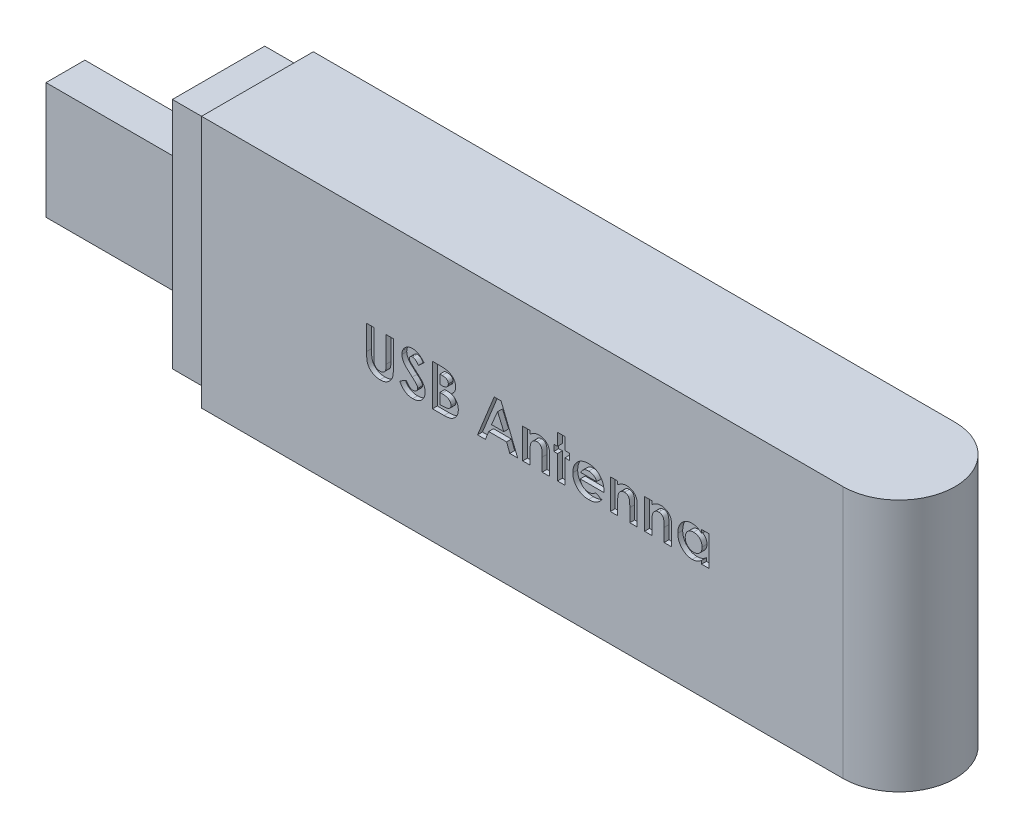
from build123d import *

# Parameters (mm, degrees)
SKETCH1_W           = 70
SKETCH1_H           = 11.5
BOSS_EXTRUDE1_DEPTH = 26
SKETCH2_W           = 11.5
SKETCH2_H           = 26
SKETCH2_W_2         = 9.5
SKETCH2_H_2         = 24
CUT_EXTRUDE1_DEPTH  = 4
SKETCH3_W           = 4
SKETCH3_H           = 12
BOSS_EXTRUDE2_DEPTH = 14
CUT_EXTRUDE3_DEPTH  = 0.5


with BuildPart() as part:
    # Sketch1 → Boss-Extrude1 (new body)
    with BuildSketch(Plane(origin=(0, 0, 0), x_dir=(1, 0, 0), z_dir=(0, 1, 0))):
        with Locations((35, 5.75)):
            Rectangle(SKETCH1_W, SKETCH1_H)
        with BuildLine():
            Line((70, 0), (70, 11.5))
            ThreePointArc((70, 11.5), (75.75, 5.75), (70, 0))
        make_face()
    extrude(amount=BOSS_EXTRUDE1_DEPTH)

    # Sketch2 → Cut-Extrude1 (cut)
    with BuildSketch(Plane.ZY):
        with Locations((-5.75, 13)):
            Rectangle(SKETCH2_W, SKETCH2_H)
        with Locations((-5.75, 13)):
            Rectangle(SKETCH2_W_2, SKETCH2_H_2, mode=Mode.SUBTRACT)
    extrude(amount=-CUT_EXTRUDE1_DEPTH, mode=Mode.SUBTRACT)

    # Sketch3 → Boss-Extrude2 (add)
    with BuildSketch(Plane.ZY):
        with Locations((-4, 13)):
            Rectangle(SKETCH3_W, SKETCH3_H)
    extrude(amount=BOSS_EXTRUDE2_DEPTH)

    # Sketch6 → Cut-Extrude3 (cut)
    # profile 1 of 10: a face of its own
    with BuildSketch(Plane.XY):
        with BuildLine():
            Line((20.968495751, 16.050859258), (21.728324811, 16.050859258))
            Line((21.728324811, 16.050859258), (21.728324811, 13.296478916))
            add(Edge.make_bspline(
                [(21.728324811, 13.296478916), (21.728366126, 13.267922695), (21.728445927, 13.21276665), (21.732440805, 13.133635783), (21.736096393, 13.060897948), (21.742692112, 12.994632778), (21.75243625, 12.934811926), (21.761871755, 12.881051125), (21.774641778, 12.8343129), (21.793833081, 12.781112564), (21.823400578, 12.721339081), (21.871712229, 12.659041786), (21.927459741, 12.602186462), (21.994276345, 12.554862244), (22.069372298, 12.516581218), (22.152334983, 12.488219213), (22.243047451, 12.472453705), (22.305770146, 12.470046811), (22.33805371, 12.468807976)],
                knots=[0, 0, 0, 0, 1.155499968, 2.231836252, 3.205919964, 4.102923608, 4.924856345, 5.658536265, 6.31071849, 6.882491295, 7.94666036, 8.992281882, 10.060072772, 11.158554251, 12.289267114, 13.461410017, 14.693379945, 16, 16, 16, 16], degree=3))
            add(Edge.make_bspline(
                [(22.33805371, 12.468807976), (22.372351013, 12.469808796), (22.439224946, 12.471760226), (22.535412453, 12.490915621), (22.624530724, 12.521417571), (22.704692821, 12.564951627), (22.775818969, 12.617134822), (22.836025764, 12.676640018), (22.883540745, 12.743585897), (22.914509242, 12.805348568), (22.931896528, 12.862195729), (22.944929164, 12.912986509), (22.954483529, 12.972914603), (22.963151563, 13.041044103), (22.968360383, 13.1180807), (22.9740085, 13.203404856), (22.976078587, 13.297600381), (22.976431418, 13.363190493), (22.976615409, 13.397393713)],
                knots=[0, 0, 0, 0, 1.261321664, 2.459363699, 3.594844139, 4.716940403, 5.803436589, 6.833651888, 7.818396249, 8.814403945, 9.360733334, 10.004355033, 10.743453831, 11.592799886, 12.532235708, 13.585170094, 14.740740724, 16, 16, 16, 16], degree=3))
            Line((22.976615409, 13.397393713), (22.976615409, 16.050859258))
            Line((22.976615409, 16.050859258), (23.736444469, 16.050859258))
            Line((23.736444469, 16.050859258), (23.736444469, 13.525445262))
            add(Edge.make_bspline(
                [(23.736444469, 13.525445262), (23.736338953, 13.474280495), (23.736136055, 13.375895638), (23.733020167, 13.234509676), (23.726387005, 13.105376278), (23.720815914, 12.988457713), (23.710033945, 12.883911489), (23.698801662, 12.791291165), (23.684485152, 12.710924965), (23.663183045, 12.619437813), (23.626421916, 12.514093707), (23.567158155, 12.392794537), (23.491926647, 12.274035301), (23.403006764, 12.159122435), (23.302608083, 12.052372085), (23.192956656, 11.958659095), (23.075794573, 11.879388011), (22.949897574, 11.816497107), (22.815372804, 11.767446942), (22.67088924, 11.734487702), (22.516545409, 11.712220026), (22.409937207, 11.710080942), (22.35501418, 11.708978916)],
                knots=[0, 0, 0, 0, 1.170808336, 2.251350247, 3.235597562, 4.129743112, 4.929140599, 5.639994148, 6.264258765, 6.79612947, 7.788252245, 8.809469599, 9.879094798, 10.999557536, 12.129761673, 13.226370002, 14.293821979, 15.358369427, 16.438775801, 17.562147481, 18.744053101, 20, 20, 20, 20], degree=3))
            add(Edge.make_bspline(
                [(22.35501418, 11.708978916), (22.318522228, 11.709593575), (22.246524356, 11.710806284), (22.140638854, 11.72149921), (22.038279716, 11.737256563), (21.939639275, 11.760244917), (21.844375168, 11.789941578), (21.752512704, 11.8264961), (21.664393266, 11.869704585), (21.58050996, 11.91916961), (21.500966009, 11.972657519), (21.428266944, 12.031951118), (21.359911019, 12.092665421), (21.297873008, 12.157355544), (21.241686952, 12.22534235), (21.191468564, 12.296779921), (21.147292453, 12.371661911), (21.108047393, 12.451338063), (21.074457452, 12.539858028), (21.04613987, 12.640370499), (21.021400964, 12.754450907), (21.003016468, 12.88235627), (20.986348977, 13.023665026), (20.975799374, 13.178745306), (20.970280402, 13.347601559), (20.969105666, 13.464666099), (20.968495751, 13.525445262)],
                knots=[0, 0, 0, 0, 1.001158378, 1.975264943, 2.917723546, 3.841610987, 4.75185031, 5.653588123, 6.552117133, 7.442167995, 8.324307438, 9.179605724, 10.014504199, 10.831958861, 11.636465792, 12.43274043, 13.225645099, 14.020104002, 14.867201867, 15.819789774, 16.883317127, 18.068162734, 19.364263498, 20.787406516, 22.332041935, 24, 24, 24, 24], degree=3))
            Line((20.968495751, 13.525445262), (20.968495751, 16.050859258))
        make_face()
    # profile 2 of 10: a face of its own
    with BuildSketch(Plane.XY):
        with BuildLine():
            Line((26.884307717, 15.48522758), (26.316131969, 14.965389172))
            add(Edge.make_bspline(
                [(26.316131969, 14.965389172), (26.291793756, 14.999720752), (26.245067781, 15.065632596), (26.169329851, 15.15389011), (26.093933915, 15.229180337), (26.018181478, 15.291188749), (25.941401098, 15.339538601), (25.863726055, 15.37377083), (25.785596711, 15.395532582), (25.733105851, 15.398242444), (25.707251093, 15.399577206)],
                knots=[0, 0, 0, 0, 1.299362458, 2.494594718, 3.587462134, 4.587049575, 5.512617175, 6.380583204, 7.202344345, 8, 8, 8, 8], degree=3))
            add(Edge.make_bspline(
                [(25.707251093, 15.399577206), (25.683134515, 15.39873144), (25.63657174, 15.397098487), (25.57019305, 15.380867053), (25.511261104, 15.352853983), (25.459833417, 15.316224537), (25.419095101, 15.272094547), (25.386568714, 15.225813534), (25.368253626, 15.174729762), (25.365843, 15.139643367), (25.364649597, 15.122273521)],
                knots=[0, 0, 0, 0, 1.185010067, 2.2879431, 3.333075148, 4.379039566, 5.372662701, 6.27520591, 7.14612461, 8, 8, 8, 8], degree=3))
            add(Edge.make_bspline(
                [(25.364649597, 15.122273521), (25.365397442, 15.104653193), (25.366903498, 15.069168301), (25.38144995, 15.017160774), (25.403375606, 14.966343365), (25.424326465, 14.93540839), (25.435035548, 14.919595903)],
                knots=[0, 0, 0, 0, 0.967525499, 1.948461899, 2.951351359, 4, 4, 4, 4], degree=3))
            add(Edge.make_bspline(
                [(25.435035548, 14.919595903), (25.444771262, 14.907305022), (25.467181591, 14.879013039), (25.509913497, 14.834202946), (25.563575798, 14.779306661), (25.63023353, 14.716211905), (25.707119548, 14.642649544), (25.797797619, 14.561511342), (25.899657632, 14.470284545), (25.97205737, 14.406757506), (26.009995484, 14.373468766)],
                knots=[0, 0, 0, 0, 0.473873513, 1.090794244, 1.870441696, 2.795289791, 3.865433203, 5.087734844, 6.473946851, 8, 8, 8, 8], degree=3))
            add(Edge.make_bspline(
                [(26.009995484, 14.373468766), (26.045605861, 14.342649781), (26.113186959, 14.28416175), (26.20934144, 14.20114738), (26.293845215, 14.126461376), (26.367929311, 14.061224615), (26.430470684, 14.004752613), (26.481732259, 13.956775435), (26.52234011, 13.918227108), (26.545423296, 13.894943895), (26.555274597, 13.885007228)],
                knots=[0, 0, 0, 0, 1.543621617, 2.929473131, 4.163658386, 5.240097082, 6.164993805, 6.925417477, 7.541396219, 8, 8, 8, 8], degree=3))
            add(Edge.make_bspline(
                [(26.555274597, 13.885007228), (26.59264838, 13.84456079), (26.664493916, 13.766808533), (26.757867786, 13.646316987), (26.834717501, 13.528692669), (26.894169899, 13.411722287), (26.93907074, 13.293718192), (26.970726428, 13.171786338), (26.98968523, 13.044652616), (26.9917901, 12.95789937), (26.992854725, 12.914020315)],
                knots=[0, 0, 0, 0, 1.206664779, 2.319633467, 3.337109185, 4.282041471, 5.190008762, 6.099243693, 7.03861361, 8, 8, 8, 8], degree=3))
            add(Edge.make_bspline(
                [(26.992854725, 12.914020315), (26.992096952, 12.871265558), (26.990610173, 12.787379133), (26.972399985, 12.664623845), (26.946433325, 12.547141707), (26.906284313, 12.43621109), (26.857350936, 12.330011103), (26.796005879, 12.230196003), (26.723964522, 12.13575562), (26.641394066, 12.048378193), (26.550061336, 11.969089234), (26.452098303, 11.89850433), (26.346547036, 11.840227501), (26.234309347, 11.792240689), (26.115445315, 11.755280605), (25.990096542, 11.727963658), (25.8580713, 11.711568457), (25.767790537, 11.709854533), (25.721667492, 11.708978916)],
                knots=[0, 0, 0, 0, 1.043214005, 2.046824704, 3.02475056, 3.976699089, 4.921714032, 5.875962561, 6.831408892, 7.817874052, 8.806269674, 9.781291748, 10.760897367, 11.74438705, 12.757449933, 13.795994037, 14.874007457, 16, 16, 16, 16], degree=3))
            add(Edge.make_bspline(
                [(25.721667492, 11.708978916), (25.685461295, 11.709621238), (25.613752259, 11.710893404), (25.508063982, 11.721279581), (25.406010004, 11.738041766), (25.307705278, 11.762066983), (25.212706925, 11.792510193), (25.121011043, 11.829695407), (25.033250639, 11.874198983), (24.948761677, 11.925105749), (24.867954877, 11.984215211), (24.789808469, 12.050318895), (24.715098677, 12.124433504), (24.643466686, 12.20638376), (24.575370816, 12.296401728), (24.508582046, 12.39323374), (24.44606867, 12.498676866), (24.407451376, 12.572646072), (24.38772652, 12.610427901)],
                knots=[0, 0, 0, 0, 1.016823716, 2.013894106, 2.979844003, 3.91962641, 4.853723003, 5.779685073, 6.695824784, 7.614987388, 8.547259901, 9.504950863, 10.487499108, 11.500346958, 12.559593716, 13.656357062, 14.802919212, 16, 16, 16, 16], degree=3))
            Line((24.38772652, 12.610427901), (25.055969041, 13.011543018))
            add(Edge.make_bspline(
                [(25.055969041, 13.011543018), (25.080641888, 12.968655707), (25.127941845, 12.886437064), (25.208096044, 12.775965898), (25.290209928, 12.68136563), (25.376181898, 12.604308326), (25.464966566, 12.543763633), (25.556992783, 12.500494194), (25.652325204, 12.47371046), (25.717261319, 12.470439548), (25.749652268, 12.468807976)],
                knots=[0, 0, 0, 0, 1.283663364, 2.460892379, 3.537111102, 4.529833553, 5.449777664, 6.316464042, 7.160231139, 8, 8, 8, 8], degree=3))
            add(Edge.make_bspline(
                [(25.749652268, 12.468807976), (25.7825985, 12.470140406), (25.846518989, 12.472725515), (25.937757308, 12.496603386), (26.021408052, 12.534093396), (26.093715139, 12.58758647), (26.15494022, 12.649325607), (26.200127845, 12.718013221), (26.228515015, 12.792331561), (26.231516228, 12.843957969), (26.233025665, 12.869923093)],
                knots=[0, 0, 0, 0, 1.13588714, 2.203786484, 3.234766741, 4.283437687, 5.291419208, 6.222934724, 7.106237994, 8, 8, 8, 8], degree=3))
            add(Edge.make_bspline(
                [(26.233025665, 12.869923093), (26.231631761, 12.894079416), (26.228800179, 12.943150675), (26.207943615, 13.016111745), (26.175338444, 13.089039633), (26.136764227, 13.148857061), (26.097510132, 13.198940571), (26.059974363, 13.242335667), (26.014265726, 13.290279652), (25.960500117, 13.342832834), (25.899387922, 13.400457853), (25.830877659, 13.463149066), (25.754184816, 13.530354239), (25.699978163, 13.576133738), (25.671634105, 13.60007133)],
                knots=[0, 0, 0, 0, 0.916159276, 1.861089862, 2.860218735, 3.940849679, 4.552606315, 5.27541173, 6.11797699, 7.06649574, 8.129236253, 9.306560635, 10.591630461, 12, 12, 12, 12], degree=3))
            add(Edge.make_bspline(
                [(25.671634105, 13.60007133), (25.617750925, 13.645661668), (25.514332792, 13.733163326), (25.368189849, 13.862400519), (25.236501972, 13.983184519), (25.120406559, 14.097008478), (25.018424375, 14.201770332), (24.931246086, 14.298320998), (24.859829388, 14.387405231), (24.784678712, 14.492919543), (24.713270544, 14.621495983), (24.651553623, 14.776188346), (24.61151429, 14.93086108), (24.60702844, 15.034699835), (24.604820537, 15.08580851)],
                knots=[0, 0, 0, 0, 1.345494975, 2.582412109, 3.71882943, 4.751509156, 5.681369928, 6.505683931, 7.230279997, 7.856715994, 8.973648664, 10.023341002, 11.027102913, 12, 12, 12, 12], degree=3))
            add(Edge.make_bspline(
                [(24.604820537, 15.08580851), (24.605738801, 15.122052039), (24.607547879, 15.193455684), (24.623685137, 15.298444341), (24.647802884, 15.399749573), (24.682828776, 15.497001773), (24.728288154, 15.590079129), (24.783496804, 15.679437293), (24.84931201, 15.764253833), (24.923481305, 15.844472521), (25.005196877, 15.917783274), (25.092520352, 15.982487359), (25.184957469, 16.03713737), (25.281942745, 16.082473523), (25.384077157, 16.117175467), (25.490608287, 16.141773935), (25.601688934, 16.15640432), (25.677243592, 16.158393151), (25.715731328, 16.159406266)],
                knots=[0, 0, 0, 0, 1.010766082, 1.991317756, 2.957454644, 3.913069143, 4.869106762, 5.843196583, 6.838735724, 7.860187025, 8.887984031, 9.89767229, 10.887916223, 11.879572884, 12.879850636, 13.892031539, 14.926195476, 16, 16, 16, 16], degree=3))
            add(Edge.make_bspline(
                [(25.715731328, 16.159406266), (25.765609529, 16.157581615), (25.864972209, 16.153946717), (26.011882798, 16.125522998), (26.15537892, 16.080823706), (26.271010784, 16.026898928), (26.363016899, 15.97466197), (26.433530992, 15.926568759), (26.505282877, 15.871475401), (26.578851189, 15.809208283), (26.652868915, 15.738594209), (26.729440731, 15.661314204), (26.807523255, 15.576700388), (26.858264514, 15.51625267), (26.884307717, 15.48522758)],
                knots=[0, 0, 0, 0, 1.282922637, 2.555718331, 3.837320111, 5.142675274, 5.830281639, 6.55870424, 7.337177975, 8.157850921, 9.037902056, 9.96903443, 10.957596896, 12, 12, 12, 12], degree=3))
        make_face()
    # profile 3 of 10: a face of its own
    with BuildSketch(Plane.XY):
        with BuildLine():
            Line((27.752683785, 11.817525924), (27.752683785, 16.050859258))
            Line((27.752683785, 16.050859258), (28.431102588, 16.050859258))
            add(Edge.make_bspline(
                [(28.431102588, 16.050859258), (28.478596147, 16.050864678), (28.570495281, 16.050875166), (28.703081749, 16.046219164), (28.826044501, 16.040196105), (28.938992221, 16.033457702), (29.042117155, 16.021846087), (29.135262484, 16.009608714), (29.218614314, 15.994851196), (29.27014622, 15.981613245), (29.294390516, 15.975385166)],
                knots=[0, 0, 0, 0, 1.311965854, 2.538629056, 3.664479157, 4.713267157, 5.663616078, 6.530575999, 7.308677837, 8, 8, 8, 8], degree=3))
            add(Edge.make_bspline(
                [(29.294390516, 15.975385166), (29.326225737, 15.966600349), (29.388696661, 15.949361719), (29.47817496, 15.914547561), (29.563057607, 15.875849155), (29.643240965, 15.831701512), (29.718232675, 15.781571646), (29.787747743, 15.725061711), (29.853285436, 15.664440014), (29.912518662, 15.598017044), (29.966055739, 15.527828873), (30.012569859, 15.453893891), (30.052984669, 15.377342612), (30.085327102, 15.29721169), (30.109696518, 15.213870148), (30.127520207, 15.127673869), (30.139072371, 15.038350107), (30.140163899, 14.977580231), (30.140717973, 14.946732655)],
                knots=[0, 0, 0, 0, 1.099996261, 2.158545794, 3.195537121, 4.207578794, 5.205712374, 6.197378256, 7.190519799, 8.17788031, 9.159561366, 10.129234751, 11.085776129, 12.040971148, 13.00380137, 13.975669004, 14.972423361, 16, 16, 16, 16], degree=3))
            add(Edge.make_bspline(
                [(30.140717973, 14.946732655), (30.139269235, 14.907101617), (30.136417571, 14.829092788), (30.118200953, 14.714511931), (30.084041954, 14.606216552), (30.039345735, 14.502210808), (29.97857285, 14.402882642), (29.901403041, 14.30827928), (29.809086205, 14.215487745), (29.738274095, 14.159865478), (29.701441798, 14.130934044)],
                knots=[0, 0, 0, 0, 0.986156485, 1.941127874, 2.875419072, 3.804401753, 4.751181392, 5.761612777, 6.835722519, 8, 8, 8, 8], degree=3))
            add(Edge.make_bspline(
                [(29.701441798, 14.130934044), (29.731288925, 14.115697345), (29.789810883, 14.085822392), (29.872894872, 14.036716889), (29.949821575, 13.984486958), (30.020935911, 13.930183487), (30.084746173, 13.871504473), (30.143887195, 13.811831082), (30.195441266, 13.747744276), (30.24154247, 13.681528231), (30.281612888, 13.612224131), (30.316509803, 13.539949015), (30.345985975, 13.464455975), (30.37094716, 13.386129211), (30.389563218, 13.304699314), (30.401701284, 13.220137162), (30.410994946, 13.132731154), (30.411717906, 13.073192365), (30.412085494, 13.042919888)],
                knots=[0, 0, 0, 0, 1.164658916, 2.283573913, 3.35186032, 4.395461096, 5.390182219, 6.362969632, 7.312859996, 8.245001507, 9.165155236, 10.092416118, 11.032087915, 11.979892451, 12.947605196, 13.931445124, 14.948243989, 16, 16, 16, 16], degree=3))
            add(Edge.make_bspline(
                [(30.412085494, 13.042919888), (30.40970009, 12.985101188), (30.404992505, 12.870996216), (30.37057294, 12.70346391), (30.310900351, 12.544628089), (30.230772368, 12.395120034), (30.132039277, 12.259267758), (30.018524536, 12.140262344), (29.891370978, 12.039526903), (29.774056451, 11.971538295), (29.672588625, 11.925911581), (29.58854472, 11.89770227), (29.498283347, 11.871569206), (29.400151136, 11.853218029), (29.295927088, 11.836421014), (29.184595014, 11.826050189), (29.06636299, 11.819022136), (28.985156125, 11.818034745), (28.943308785, 11.817525924)],
                knots=[0, 0, 0, 0, 1.284142165, 2.534249414, 3.780121997, 5.041676246, 6.291546858, 7.49970053, 8.684500223, 9.883330709, 10.50184324, 11.153274765, 11.851151195, 12.587658647, 13.369265475, 14.195992086, 15.070362669, 16, 16, 16, 16], degree=3))
            Line((28.943308785, 11.817525924), (27.752683785, 11.817525924))
        make_face()
        with BuildLine():
            Line((28.512512845, 15.291030198), (28.512512845, 14.368380625))
            Line((28.512512845, 14.368380625), (28.714342439, 14.368380625))
            add(Edge.make_bspline(
                [(28.714342439, 14.368380625), (28.741772894, 14.368619829), (28.794725728, 14.369081598), (28.871210479, 14.375029019), (28.942328946, 14.385175689), (29.007811391, 14.399332846), (29.068267808, 14.417310371), (29.123311983, 14.438941205), (29.172701898, 14.465333174), (29.230081555, 14.504645177), (29.29073599, 14.562494548), (29.344129407, 14.646069952), (29.375577773, 14.742181347), (29.379080273, 14.809966546), (29.380888913, 14.844969835)],
                knots=[0, 0, 0, 0, 1.065314748, 2.056525647, 2.977365736, 3.853934255, 4.656397591, 5.425096493, 6.14721249, 6.826394842, 8.123232004, 9.372140726, 10.643011755, 12, 12, 12, 12], degree=3))
            add(Edge.make_bspline(
                [(29.380888913, 14.844969835), (29.37944167, 14.87775623), (29.376643484, 14.941147409), (29.344979023, 15.03015427), (29.295797854, 15.109032564), (29.237732572, 15.163018306), (29.183052826, 15.199888977), (29.136232672, 15.224166743), (29.084844037, 15.245899951), (29.027892092, 15.262517692), (28.965702065, 15.274987059), (28.898576047, 15.284144316), (28.826398221, 15.290377135), (28.776544844, 15.290807841), (28.750807449, 15.291030198)],
                knots=[0, 0, 0, 0, 1.347982417, 2.606269829, 3.849316587, 5.153353503, 5.842674298, 6.568177932, 7.326619318, 8.142485038, 9.012069166, 9.942760135, 10.937925643, 12, 12, 12, 12], degree=3))
            Line((28.750807449, 15.291030198), (28.512512845, 15.291030198))
        make_face(mode=Mode.SUBTRACT)
        with BuildLine():
            Line((28.512512845, 13.66282507), (28.512512845, 12.577354984))
            Line((28.512512845, 12.577354984), (28.731302909, 12.577354984))
            add(Edge.make_bspline(
                [(28.731302909, 12.577354984), (28.774557983, 12.577602099), (28.857721261, 12.578077208), (28.976852509, 12.583817651), (29.085172596, 12.594163788), (29.182394516, 12.607080107), (29.26866718, 12.624579699), (29.343698969, 12.646828187), (29.408518844, 12.6713054), (29.462738143, 12.701537663), (29.507032205, 12.736720521), (29.547002951, 12.772678247), (29.579592607, 12.814158881), (29.605378151, 12.859381774), (29.627695494, 12.907223557), (29.641155739, 12.959552435), (29.651403898, 13.014817505), (29.651967881, 13.053043159), (29.652256434, 13.072600711)],
                knots=[0, 0, 0, 0, 1.753078804, 3.370512758, 4.83203934, 6.162291463, 7.344201807, 8.395507345, 9.331626367, 10.147333109, 10.898971645, 11.62040215, 12.321813352, 13.025280112, 13.727906689, 14.453419512, 15.208716525, 16, 16, 16, 16], degree=3))
            add(Edge.make_bspline(
                [(29.652256434, 13.072600711), (29.651620092, 13.094965079), (29.650380667, 13.138524852), (29.640258271, 13.202192109), (29.621862571, 13.261629717), (29.598692289, 13.318357578), (29.566449611, 13.370344634), (29.52813029, 13.419389963), (29.481830768, 13.463832736), (29.429764254, 13.50636102), (29.369033821, 13.543596837), (29.299610975, 13.575905503), (29.221118574, 13.602888512), (29.133313479, 13.624372401), (29.036580621, 13.642605481), (28.930213956, 13.653492642), (28.815099343, 13.661589902), (28.735276997, 13.662403992), (28.693989875, 13.66282507)],
                knots=[0, 0, 0, 0, 0.845221588, 1.646264278, 2.427170338, 3.19324141, 3.95557735, 4.731569926, 5.540061037, 6.376114724, 7.268642756, 8.224665384, 9.265483498, 10.400594375, 11.639216012, 12.983232105, 14.439614077, 16, 16, 16, 16], degree=3))
            Line((28.693989875, 13.66282507), (28.512512845, 13.66282507))
        make_face(mode=Mode.SUBTRACT)
    # profile 4 of 10: a face of its own
    with BuildSketch(Plane.XY):
        Polygon((34.103531808, 16.050859258), (34.80823934, 16.050859258), (36.517854725, 11.817525924), (35.706296232, 11.817525924), (35.377263112, 12.685901993), (33.53281199, 12.685901993), (33.20377887, 11.817525924), (32.3930684, 11.817525924), align=None)
        Polygon((34.455461563, 14.915355786), (33.821139982, 13.445731053), (35.089783144, 13.445731053), align=None, mode=Mode.SUBTRACT)
    # profile 5 of 10: a face of its own
    with BuildSketch(Plane.XY):
        with BuildLine():
            Line((37.033453016, 14.911115668), (37.793282076, 14.911115668))
            Line((37.793282076, 14.911115668), (37.793282076, 14.583778595))
            add(Edge.make_bspline(
                [(37.793282076, 14.583778595), (37.836629947, 14.617495462), (37.919476155, 14.68193495), (38.045416696, 14.764095624), (38.164288974, 14.831340837), (38.278742779, 14.882490987), (38.390931564, 14.919291321), (38.502672304, 14.945730165), (38.615629048, 14.962659684), (38.691563398, 14.964479831), (38.729500024, 14.965389172)],
                knots=[0, 0, 0, 0, 1.276643801, 2.439914479, 3.493451431, 4.44993799, 5.350072675, 6.235028322, 7.118224225, 8, 8, 8, 8], degree=3))
            add(Edge.make_bspline(
                [(38.729500024, 14.965389172), (38.767981626, 14.964349983), (38.843524243, 14.962309969), (38.954756583, 14.948041718), (39.061028282, 14.922054713), (39.163534277, 14.887550999), (39.261231232, 14.842008075), (39.355315996, 14.787933243), (39.44376766, 14.722066438), (39.49824011, 14.671905442), (39.525794095, 14.646532335)],
                knots=[0, 0, 0, 0, 1.048836932, 2.058954983, 3.049370783, 4.026390553, 5.001981509, 5.982488534, 6.97947532, 8, 8, 8, 8], degree=3))
            add(Edge.make_bspline(
                [(39.525794095, 14.646532335), (39.547893405, 14.623018884), (39.592253765, 14.575819892), (39.648075706, 14.495050329), (39.695977209, 14.40699672), (39.735225836, 14.310643341), (39.764228989, 14.20546079), (39.786541511, 14.092719524), (39.799061456, 13.971788273), (39.800607103, 13.888709645), (39.801401734, 13.845998147)],
                knots=[0, 0, 0, 0, 0.889584746, 1.785680191, 2.700364693, 3.65222533, 4.649950538, 5.707241244, 6.821271309, 8, 8, 8, 8], degree=3))
            Line((39.801401734, 13.845998147), (39.801401734, 11.817525924))
            Line((39.801401734, 11.817525924), (39.041572674, 11.817525924))
            Line((39.041572674, 11.817525924), (39.041572674, 13.160795155))
            add(Edge.make_bspline(
                [(39.041572674, 13.160795155), (39.041411987, 13.204610257), (39.04110406, 13.288573768), (39.038739862, 13.408738171), (39.034123571, 13.517262232), (39.029915942, 13.614343541), (39.021654694, 13.699637395), (39.014204567, 13.77368377), (39.002773069, 13.83581091), (38.987898836, 13.902637972), (38.961924762, 13.974188561), (38.921601277, 14.049578928), (38.870445282, 14.113624725), (38.810546193, 14.166774946), (38.741970162, 14.208821646), (38.665545831, 14.238404118), (38.581682926, 14.256840641), (38.52324824, 14.258810575), (38.492901467, 14.259833617)],
                knots=[0, 0, 0, 0, 1.49886392, 2.872294502, 4.110984203, 5.214877267, 6.195405875, 7.042225351, 7.75923308, 8.355011229, 9.382752534, 10.352059385, 11.267231453, 12.171456522, 13.078624015, 14.003401117, 14.963110155, 16, 16, 16, 16], degree=3))
            add(Edge.make_bspline(
                [(38.492901467, 14.259833617), (38.453434212, 14.257832222), (38.376228589, 14.253917104), (38.2645661, 14.224393544), (38.162005965, 14.174182659), (38.069386184, 14.10470089), (37.987588883, 14.018917038), (37.920218455, 13.916609952), (37.864960865, 13.800248811), (37.84119928, 13.715286276), (37.828899063, 13.671305305)],
                knots=[0, 0, 0, 0, 0.984188326, 1.925263693, 2.85911992, 3.81709677, 4.80007086, 5.801799564, 6.862098548, 8, 8, 8, 8], degree=3))
            add(Edge.make_bspline(
                [(37.828899063, 13.671305305), (37.82584197, 13.657492786), (37.819024039, 13.626688092), (37.813417153, 13.574646928), (37.805617568, 13.512905126), (37.802695255, 13.440345333), (37.797613674, 13.357310944), (37.795734263, 13.263692107), (37.793851489, 13.159672391), (37.793478168, 13.087018573), (37.793282076, 13.048856053)],
                knots=[0, 0, 0, 0, 0.543362196, 1.211806945, 2.009705693, 2.934833164, 4.000995085, 5.207458376, 6.533175157, 8, 8, 8, 8], degree=3))
            Line((37.793282076, 13.048856053), (37.793282076, 11.817525924))
            Line((37.793282076, 11.817525924), (37.033453016, 11.817525924))
            Line((37.033453016, 11.817525924), (37.033453016, 14.911115668))
        make_face()
    # profile 6 of 10: a face of its own
    with BuildSketch(Plane.XY):
        Polygon((40.615504298, 16.159406266), (41.375333358, 16.159406266), (41.375333358, 14.911115668), (41.863794896, 14.911115668), (41.863794896, 14.259833617), (41.375333358, 14.259833617), (41.375333358, 11.817525924), (40.615504298, 11.817525924), (40.615504298, 14.259833617), (40.235589768, 14.259833617), (40.235589768, 14.911115668), (40.615504298, 14.911115668), align=None)
    # profile 7 of 10: a face of its own
    with BuildSketch(Plane.XY):
        with BuildLine():
            Line((45.389028603, 13.174363531), (42.949264982, 13.174363531))
            add(Edge.make_bspline(
                [(42.949264982, 13.174363531), (42.954239463, 13.146014862), (42.96401471, 13.090307491), (42.985242008, 13.0093877), (43.012331224, 12.933130254), (43.044795943, 12.861433218), (43.08208881, 12.793917555), (43.12558785, 12.730899941), (43.174741318, 12.672436038), (43.22926502, 12.618779935), (43.288250146, 12.570702904), (43.351410639, 12.528584386), (43.418811678, 12.494049778), (43.489680535, 12.464940686), (43.564546763, 12.441883337), (43.643520547, 12.425981122), (43.726392538, 12.416587625), (43.78284747, 12.415228963), (43.811704885, 12.414534471)],
                knots=[0, 0, 0, 0, 1.091296461, 2.144483647, 3.168565212, 4.157007626, 5.126487748, 6.090021542, 7.05641414, 8.019231907, 8.98705074, 9.938580405, 10.892824166, 11.854447369, 12.841318655, 13.858982407, 14.905600794, 16, 16, 16, 16], degree=3))
            add(Edge.make_bspline(
                [(43.811704885, 12.414534471), (43.846537744, 12.415454093), (43.915133901, 12.417265097), (44.015627782, 12.43332602), (44.112820003, 12.457585338), (44.205790785, 12.493660981), (44.295617046, 12.538568814), (44.380819972, 12.594518448), (44.462874357, 12.659874852), (44.512937202, 12.710251543), (44.538461029, 12.73593538)],
                knots=[0, 0, 0, 0, 1.021034703, 2.010718019, 2.977989445, 3.954245119, 4.929443971, 5.918328161, 6.938689359, 8, 8, 8, 8], degree=3))
            Line((44.538461029, 12.73593538), (45.174478657, 12.433190989))
            add(Edge.make_bspline(
                [(45.174478657, 12.433190989), (45.154454013, 12.405520004), (45.114775918, 12.350690966), (45.050002759, 12.273532349), (44.982407842, 12.201540229), (44.911940757, 12.135188109), (44.838512133, 12.074665067), (44.762326231, 12.019233822), (44.682269624, 11.970382682), (44.599943031, 11.925748258), (44.513644608, 11.887483372), (44.423613181, 11.854852429), (44.330230084, 11.825354334), (44.23231609, 11.802878401), (44.130686527, 11.785086636), (44.025098279, 11.772452126), (43.915565261, 11.764648395), (43.841116307, 11.763723272), (43.80322465, 11.76325242)],
                knots=[0, 0, 0, 0, 1.028154879, 2.037251081, 3.030720504, 4.000128189, 4.949298328, 5.894184978, 6.834267904, 7.770992897, 8.712077017, 9.673380525, 10.653304757, 11.658697181, 12.695551717, 13.758623199, 14.859225354, 16, 16, 16, 16], degree=3))
            add(Edge.make_bspline(
                [(43.80322465, 11.76325242), (43.744928959, 11.764440894), (43.630760208, 11.766768451), (43.463767771, 11.788371515), (43.305171273, 11.824191722), (43.154522892, 11.872883793), (43.012473833, 11.937172581), (42.878953793, 12.015803101), (42.752628716, 12.107267849), (42.63735854, 12.213486427), (42.532344009, 12.329099035), (42.440105774, 12.453259081), (42.362922132, 12.585099105), (42.299537374, 12.723746564), (42.250272537, 12.86955634), (42.214755448, 13.022592061), (42.192983046, 13.182780635), (42.190631519, 13.291886935), (42.189435922, 13.347360326)],
                knots=[0, 0, 0, 0, 1.103565453, 2.161269334, 3.182010356, 4.179077853, 5.15417608, 6.128274628, 7.109042802, 8.101804412, 9.090965879, 10.063106201, 11.02526161, 11.978650795, 12.945248442, 13.93468508, 14.949922959, 16, 16, 16, 16], degree=3))
            add(Edge.make_bspline(
                [(42.189435922, 13.347360326), (42.190643286, 13.404243367), (42.193018722, 13.516158195), (42.214567988, 13.680045596), (42.25037073, 13.836416344), (42.299779677, 13.985485777), (42.362202881, 14.127720121), (42.440368552, 14.261874995), (42.532298236, 14.388417454), (42.636934455, 14.506755519), (42.752692951, 14.613568552), (42.875697289, 14.708760309), (43.007329551, 14.788080401), (43.14610086, 14.852170985), (43.291123586, 14.904242967), (43.444073989, 14.938892522), (43.60378835, 14.962157624), (43.712965569, 14.964300195), (43.768455687, 14.965389172)],
                knots=[0, 0, 0, 0, 1.079208495, 2.12329425, 3.130605359, 4.119693003, 5.099659317, 6.073216462, 7.060498243, 8.06384408, 9.066070512, 10.045757761, 11.010926815, 11.975797609, 12.942977511, 13.929384301, 14.947594487, 16, 16, 16, 16], degree=3))
            add(Edge.make_bspline(
                [(43.768455687, 14.965389172), (43.827030654, 14.96418226), (43.942036565, 14.961812613), (44.110192053, 14.940384961), (44.269841612, 14.904346326), (44.421665441, 14.856075287), (44.563724684, 14.790162497), (44.699140817, 14.713466949), (44.82466579, 14.620025121), (44.941637567, 14.514326342), (45.047228502, 14.39705721), (45.139526679, 14.269667016), (45.218061068, 14.133399013), (45.281713969, 13.987700606), (45.33092822, 13.833009194), (45.366478186, 13.669525677), (45.388084516, 13.49662824), (45.390392287, 13.378235455), (45.391572674, 13.317679503)],
                knots=[0, 0, 0, 0, 1.080001299, 2.120471247, 3.119684163, 4.095710327, 5.052285597, 6.002875087, 6.961153713, 7.931888285, 8.906493152, 9.865905668, 10.82813294, 11.801621613, 12.7925306, 13.817193356, 14.883530496, 16, 16, 16, 16], degree=3))
            Line((45.391572674, 13.317679503), (45.389028603, 13.174363531))
        make_face()
        with BuildLine():
            add(Edge.make_bspline(
                [(44.631743614, 13.771372078), (44.617405175, 13.810065717), (44.588896623, 13.886998751), (44.52449699, 13.993147566), (44.439040738, 14.08507675), (44.339648986, 14.166462386), (44.226087687, 14.232520052), (44.101935354, 14.280347948), (43.96876125, 14.309026154), (43.877144643, 14.312389604), (43.830361402, 14.314107121)],
                knots=[0, 0, 0, 0, 0.954238005, 1.897273737, 2.851915805, 3.847685534, 4.862635127, 5.880135777, 6.917509367, 8, 8, 8, 8], degree=3))
            add(Edge.make_bspline(
                [(43.830361402, 14.314107121), (43.779266486, 14.312457237), (43.679386564, 14.309232057), (43.535316577, 14.274931083), (43.399418963, 14.223737903), (43.319301431, 14.170956649), (43.279146125, 14.14450242)],
                knots=[0, 0, 0, 0, 1.044195649, 2.041185066, 3.018232172, 4, 4, 4, 4], degree=3))
            add(Edge.make_bspline(
                [(43.279146125, 14.14450242), (43.254092212, 14.1243543), (43.200678552, 14.081399539), (43.131310077, 13.995708867), (43.062981553, 13.891956701), (43.024133019, 13.8131496), (43.003538486, 13.771372078)],
                knots=[0, 0, 0, 0, 0.82159062, 1.751589201, 2.808063854, 4, 4, 4, 4], degree=3))
            Line((43.003538486, 13.771372078), (44.631743614, 13.771372078))
        make_face(mode=Mode.SUBTRACT)
    # profile 8 of 10: a face of its own
    with BuildSketch(Plane.XY):
        with BuildLine():
            Line((46.042854725, 14.911115668), (46.802683785, 14.911115668))
            Line((46.802683785, 14.911115668), (46.802683785, 14.583778595))
            add(Edge.make_bspline(
                [(46.802683785, 14.583778595), (46.846031656, 14.617495462), (46.928877865, 14.68193495), (47.054818406, 14.764095624), (47.173690683, 14.831340837), (47.288144489, 14.882490987), (47.400333273, 14.919291321), (47.512074014, 14.945730165), (47.625030757, 14.962659684), (47.700965108, 14.964479831), (47.738901734, 14.965389172)],
                knots=[0, 0, 0, 0, 1.276643801, 2.439914479, 3.493451431, 4.44993799, 5.350072675, 6.235028322, 7.118224225, 8, 8, 8, 8], degree=3))
            add(Edge.make_bspline(
                [(47.738901734, 14.965389172), (47.777383336, 14.964349983), (47.852925952, 14.962309969), (47.964158293, 14.948041718), (48.070429991, 14.922054713), (48.172935986, 14.887550999), (48.270632942, 14.842008075), (48.364717705, 14.787933243), (48.453169369, 14.722066438), (48.507641819, 14.671905442), (48.535195804, 14.646532335)],
                knots=[0, 0, 0, 0, 1.048836932, 2.058954983, 3.049370783, 4.026390553, 5.001981509, 5.982488534, 6.97947532, 8, 8, 8, 8], degree=3))
            add(Edge.make_bspline(
                [(48.535195804, 14.646532335), (48.557295114, 14.623018884), (48.601655475, 14.575819892), (48.657477415, 14.495050329), (48.705378919, 14.40699672), (48.744627545, 14.310643341), (48.773630699, 14.20546079), (48.795943221, 14.092719524), (48.808463166, 13.971788273), (48.810008812, 13.888709645), (48.810803443, 13.845998147)],
                knots=[0, 0, 0, 0, 0.889584746, 1.785680191, 2.700364693, 3.65222533, 4.649950538, 5.707241244, 6.821271309, 8, 8, 8, 8], degree=3))
            Line((48.810803443, 13.845998147), (48.810803443, 11.817525924))
            Line((48.810803443, 11.817525924), (48.050974383, 11.817525924))
            Line((48.050974383, 11.817525924), (48.050974383, 13.160795155))
            add(Edge.make_bspline(
                [(48.050974383, 13.160795155), (48.050813696, 13.204610257), (48.050505769, 13.288573768), (48.048141572, 13.408738171), (48.043525281, 13.517262232), (48.039317652, 13.614343541), (48.031056404, 13.699637395), (48.023606276, 13.77368377), (48.012174779, 13.83581091), (47.997300545, 13.902637972), (47.971326471, 13.974188561), (47.931002986, 14.049578928), (47.879846992, 14.113624725), (47.819947902, 14.166774946), (47.751371871, 14.208821646), (47.674947541, 14.238404118), (47.591084636, 14.256840641), (47.532649949, 14.258810575), (47.502303176, 14.259833617)],
                knots=[0, 0, 0, 0, 1.49886392, 2.872294502, 4.110984203, 5.214877267, 6.195405875, 7.042225351, 7.75923308, 8.355011229, 9.382752534, 10.352059385, 11.267231453, 12.171456522, 13.078624015, 14.003401117, 14.963110155, 16, 16, 16, 16], degree=3))
            add(Edge.make_bspline(
                [(47.502303176, 14.259833617), (47.462835921, 14.257832222), (47.385630298, 14.253917104), (47.27396781, 14.224393544), (47.171407675, 14.174182659), (47.078787894, 14.10470089), (46.996990593, 14.018917038), (46.929620165, 13.916609952), (46.874362574, 13.800248811), (46.850600989, 13.715286276), (46.838300772, 13.671305305)],
                knots=[0, 0, 0, 0, 0.984188326, 1.925263693, 2.85911992, 3.81709677, 4.80007086, 5.801799564, 6.862098548, 8, 8, 8, 8], degree=3))
            add(Edge.make_bspline(
                [(46.838300772, 13.671305305), (46.83524368, 13.657492786), (46.828425748, 13.626688092), (46.822818863, 13.574646928), (46.815019277, 13.512905126), (46.812096964, 13.440345333), (46.807015384, 13.357310944), (46.805135973, 13.263692107), (46.803253199, 13.159672391), (46.802879877, 13.087018573), (46.802683785, 13.048856053)],
                knots=[0, 0, 0, 0, 0.543362196, 1.211806945, 2.009705693, 2.934833164, 4.000995085, 5.207458376, 6.533175157, 8, 8, 8, 8], degree=3))
            Line((46.802683785, 13.048856053), (46.802683785, 11.817525924))
            Line((46.802683785, 11.817525924), (46.042854725, 11.817525924))
            Line((46.042854725, 11.817525924), (46.042854725, 14.911115668))
        make_face()
    # profile 9 of 10: a face of its own
    with BuildSketch(Plane.XY):
        with BuildLine():
            Line((49.570632503, 14.911115668), (50.330461563, 14.911115668))
            Line((50.330461563, 14.911115668), (50.330461563, 14.583778595))
            add(Edge.make_bspline(
                [(50.330461563, 14.583778595), (50.373809434, 14.617495462), (50.456655642, 14.68193495), (50.582596183, 14.764095624), (50.701468461, 14.831340837), (50.815922267, 14.882490987), (50.928111051, 14.919291321), (51.039851792, 14.945730165), (51.152808535, 14.962659684), (51.228742885, 14.964479831), (51.266679511, 14.965389172)],
                knots=[0, 0, 0, 0, 1.276643801, 2.439914479, 3.493451431, 4.44993799, 5.350072675, 6.235028322, 7.118224225, 8, 8, 8, 8], degree=3))
            add(Edge.make_bspline(
                [(51.266679511, 14.965389172), (51.305161113, 14.964349983), (51.38070373, 14.962309969), (51.49193607, 14.948041718), (51.598207769, 14.922054713), (51.700713764, 14.887550999), (51.79841072, 14.842008075), (51.892495483, 14.787933243), (51.980947147, 14.722066438), (52.035419597, 14.671905442), (52.062973582, 14.646532335)],
                knots=[0, 0, 0, 0, 1.048836932, 2.058954983, 3.049370783, 4.026390553, 5.001981509, 5.982488534, 6.97947532, 8, 8, 8, 8], degree=3))
            add(Edge.make_bspline(
                [(52.062973582, 14.646532335), (52.085072892, 14.623018884), (52.129433253, 14.575819892), (52.185255193, 14.495050329), (52.233156697, 14.40699672), (52.272405323, 14.310643341), (52.301408477, 14.20546079), (52.323720998, 14.092719524), (52.336240944, 13.971788273), (52.33778659, 13.888709645), (52.338581221, 13.845998147)],
                knots=[0, 0, 0, 0, 0.889584746, 1.785680191, 2.700364693, 3.65222533, 4.649950538, 5.707241244, 6.821271309, 8, 8, 8, 8], degree=3))
            Line((52.338581221, 13.845998147), (52.338581221, 11.817525924))
            Line((52.338581221, 11.817525924), (51.578752161, 11.817525924))
            Line((51.578752161, 11.817525924), (51.578752161, 13.160795155))
            add(Edge.make_bspline(
                [(51.578752161, 13.160795155), (51.578591474, 13.204610257), (51.578283547, 13.288573768), (51.575919349, 13.408738171), (51.571303059, 13.517262232), (51.56709543, 13.614343541), (51.558834181, 13.699637395), (51.551384054, 13.77368377), (51.539952556, 13.83581091), (51.525078323, 13.902637972), (51.499104249, 13.974188561), (51.458780764, 14.049578928), (51.40762477, 14.113624725), (51.34772568, 14.166774946), (51.279149649, 14.208821646), (51.202725318, 14.238404118), (51.118862413, 14.256840641), (51.060427727, 14.258810575), (51.030080954, 14.259833617)],
                knots=[0, 0, 0, 0, 1.49886392, 2.872294502, 4.110984203, 5.214877267, 6.195405875, 7.042225351, 7.75923308, 8.355011229, 9.382752534, 10.352059385, 11.267231453, 12.171456522, 13.078624015, 14.003401117, 14.963110155, 16, 16, 16, 16], degree=3))
            add(Edge.make_bspline(
                [(51.030080954, 14.259833617), (50.990613699, 14.257832222), (50.913408076, 14.253917104), (50.801745588, 14.224393544), (50.699185453, 14.174182659), (50.606565671, 14.10470089), (50.52476837, 14.018917038), (50.457397943, 13.916609952), (50.402140352, 13.800248811), (50.378378767, 13.715286276), (50.36607855, 13.671305305)],
                knots=[0, 0, 0, 0, 0.984188326, 1.925263693, 2.85911992, 3.81709677, 4.80007086, 5.801799564, 6.862098548, 8, 8, 8, 8], degree=3))
            add(Edge.make_bspline(
                [(50.36607855, 13.671305305), (50.363021457, 13.657492786), (50.356203526, 13.626688092), (50.35059664, 13.574646928), (50.342797055, 13.512905126), (50.339874742, 13.440345333), (50.334793162, 13.357310944), (50.33291375, 13.263692107), (50.331030976, 13.159672391), (50.330657655, 13.087018573), (50.330461563, 13.048856053)],
                knots=[0, 0, 0, 0, 0.543362196, 1.211806945, 2.009705693, 2.934833164, 4.000995085, 5.207458376, 6.533175157, 8, 8, 8, 8], degree=3))
            Line((50.330461563, 13.048856053), (50.330461563, 11.817525924))
            Line((50.330461563, 11.817525924), (49.570632503, 11.817525924))
            Line((49.570632503, 11.817525924), (49.570632503, 14.911115668))
        make_face()
    # profile 10 of 10: a face of its own
    with BuildSketch(Plane.XY):
        with BuildLine():
            Line((55.432170964, 14.911115668), (56.192000024, 14.911115668))
            Line((56.192000024, 14.911115668), (56.192000024, 11.817525924))
            Line((56.192000024, 11.817525924), (55.432170964, 11.817525924))
            Line((55.432170964, 11.817525924), (55.432170964, 12.155039279))
            add(Edge.make_bspline(
                [(55.432170964, 12.155039279), (55.394521714, 12.12218609), (55.321451955, 12.058424536), (55.206317659, 11.9756923), (55.090846927, 11.907448897), (54.974484919, 11.853096749), (54.8554432, 11.812963282), (54.732864717, 11.783905714), (54.60498421, 11.766769755), (54.518052803, 11.764437078), (54.473904405, 11.76325242)],
                knots=[0, 0, 0, 0, 1.129196829, 2.191548051, 3.199897424, 4.157751732, 5.089409408, 6.034969131, 7.002052659, 8, 8, 8, 8], degree=3))
            add(Edge.make_bspline(
                [(54.473904405, 11.76325242), (54.424345864, 11.764367332), (54.326415381, 11.766570462), (54.182713267, 11.789761955), (54.043954591, 11.825261705), (53.910251984, 11.875498289), (53.781848707, 11.940595052), (53.657762085, 12.01885353), (53.540119342, 12.113021064), (53.42794114, 12.219023263), (53.325231452, 12.335626436), (53.235441673, 12.461212148), (53.159755563, 12.593999242), (53.097749982, 12.733547467), (53.048974586, 12.879754403), (53.014204708, 13.033083775), (52.99369044, 13.193590343), (52.991151351, 13.302921131), (52.989863272, 13.358384632)],
                knots=[0, 0, 0, 0, 0.980476535, 1.937477201, 2.874147792, 3.812856188, 4.758993464, 5.720109578, 6.712210464, 7.737600662, 8.772720504, 9.783789959, 10.789002326, 11.793715968, 12.802552247, 13.835794126, 14.902098527, 16, 16, 16, 16], degree=3))
            add(Edge.make_bspline(
                [(52.989863272, 13.358384632), (52.991215116, 13.415817159), (52.993866909, 13.528477462), (53.013264615, 13.693801099), (53.047392858, 13.85093226), (53.09392917, 14.000088593), (53.153790056, 14.141295868), (53.226696614, 14.274785427), (53.313640672, 14.40020835), (53.413828285, 14.51542985), (53.5220063, 14.621035921), (53.637737652, 14.71297438), (53.759212556, 14.791080379), (53.8865601, 14.854845185), (54.019762097, 14.904119399), (54.15829267, 14.940142874), (54.302766795, 14.961758224), (54.40118374, 14.964168805), (54.45100777, 14.965389172)],
                knots=[0, 0, 0, 0, 1.136281865, 2.228943489, 3.287578264, 4.313574083, 5.316051562, 6.317280042, 7.318008486, 8.329309503, 9.333984563, 10.305318864, 11.248632312, 12.186624717, 13.117503092, 14.05354244, 15.014596925, 16, 16, 16, 16], degree=3))
            add(Edge.make_bspline(
                [(54.45100777, 14.965389172), (54.497160966, 14.96443033), (54.588481505, 14.962533127), (54.722709539, 14.94193313), (54.852891373, 14.910777097), (54.978316857, 14.866385358), (55.100014774, 14.810331757), (55.215891843, 14.740092417), (55.328482978, 14.658619465), (55.397181273, 14.594987364), (55.432170964, 14.562578008)],
                knots=[0, 0, 0, 0, 1.017011718, 2.012299608, 2.98747302, 3.965332399, 4.941441765, 5.936729654, 6.94912688, 8, 8, 8, 8], degree=3))
            Line((55.432170964, 14.562578008), (55.432170964, 14.911115668))
        make_face()
        with BuildLine():
            add(Edge.make_bspline(
                [(54.610436189, 14.259833617), (54.580159241, 14.258904615), (54.520818399, 14.257083834), (54.433549571, 14.246131704), (54.35014675, 14.226833563), (54.27120476, 14.198324704), (54.195547075, 14.16359676), (54.124322568, 14.120100582), (54.056943402, 14.068689023), (53.993805842, 14.010606758), (53.936246652, 13.946763729), (53.886627272, 13.877097151), (53.844458814, 13.803484144), (53.808795259, 13.725703378), (53.783268245, 13.642834467), (53.76305086, 13.555956215), (53.752559346, 13.464358873), (53.750657566, 13.40193812), (53.749692332, 13.370256961)],
                knots=[0, 0, 0, 0, 1.04836806, 2.054732945, 3.03993516, 4.00574415, 4.955904794, 5.917688631, 6.888591924, 7.88601754, 8.884115178, 9.859153345, 10.841239365, 11.818093293, 12.814750328, 13.83810466, 14.90274714, 16, 16, 16, 16], degree=3))
            add(Edge.make_bspline(
                [(53.749692332, 13.370256961), (53.750642821, 13.338288435), (53.75251575, 13.275294826), (53.763220498, 13.182924828), (53.782710378, 13.094777489), (53.811145377, 13.011565422), (53.845871108, 12.93216582), (53.888140131, 12.85694512), (53.940060222, 12.787233317), (53.997669868, 12.721380797), (54.062102686, 12.662577052), (54.129863111, 12.610364725), (54.201876695, 12.566678705), (54.277362144, 12.531371387), (54.356065368, 12.502598891), (54.438973069, 12.483543288), (54.525273061, 12.471361402), (54.584106044, 12.469664995), (54.613828283, 12.468807976)],
                knots=[0, 0, 0, 0, 1.099136573, 2.165835871, 3.191374663, 4.196217796, 5.183857741, 6.167377911, 7.154730987, 8.166690795, 9.170734848, 10.148332609, 11.103258353, 12.059567475, 13.009337315, 13.978056681, 14.978520572, 16, 16, 16, 16], degree=3))
            add(Edge.make_bspline(
                [(54.613828283, 12.468807976), (54.644669175, 12.469742185), (54.705134088, 12.471573744), (54.793826663, 12.482425923), (54.878349883, 12.501794823), (54.958352084, 12.530466901), (55.035055226, 12.564945568), (55.10776713, 12.607591797), (55.175698763, 12.65888538), (55.239194168, 12.717492711), (55.297375467, 12.781857057), (55.347681044, 12.852437201), (55.391499042, 12.926975796), (55.425959882, 13.007235206), (55.453326621, 13.091811267), (55.472961626, 13.181228875), (55.48364193, 13.275584434), (55.485498478, 13.339985779), (55.486444469, 13.372801031)],
                knots=[0, 0, 0, 0, 1.050008698, 2.058587853, 3.036635738, 3.995319155, 4.947022481, 5.895997462, 6.858296291, 7.838991643, 8.833936038, 9.806048392, 10.784806122, 11.771666913, 12.772873988, 13.80724452, 14.882696879, 16, 16, 16, 16], degree=3))
            add(Edge.make_bspline(
                [(55.486444469, 13.372801031), (55.485510233, 13.405051877), (55.483685398, 13.468047146), (55.472915564, 13.560432605), (55.453141163, 13.64809446), (55.426337676, 13.731193844), (55.391263767, 13.809540752), (55.347412615, 13.882266503), (55.297658861, 13.951890773), (55.238833412, 14.014516281), (55.175681976, 14.07269925), (55.106751298, 14.122441678), (55.034213068, 14.165311082), (54.95762161, 14.200508517), (54.876267723, 14.226309571), (54.791600059, 14.246286382), (54.702297627, 14.25707726), (54.64155636, 14.258899838), (54.610436189, 14.259833617)],
                knots=[0, 0, 0, 0, 1.106611376, 2.161533483, 3.185006901, 4.184773755, 5.152708835, 6.122342771, 7.094156588, 8.082475533, 9.064254463, 10.03606828, 10.992420271, 11.951521816, 12.920622147, 13.915721683, 14.932141191, 16, 16, 16, 16], degree=3))
        make_face(mode=Mode.SUBTRACT)
    extrude(amount=-CUT_EXTRUDE3_DEPTH, mode=Mode.SUBTRACT)


solid = part.part
